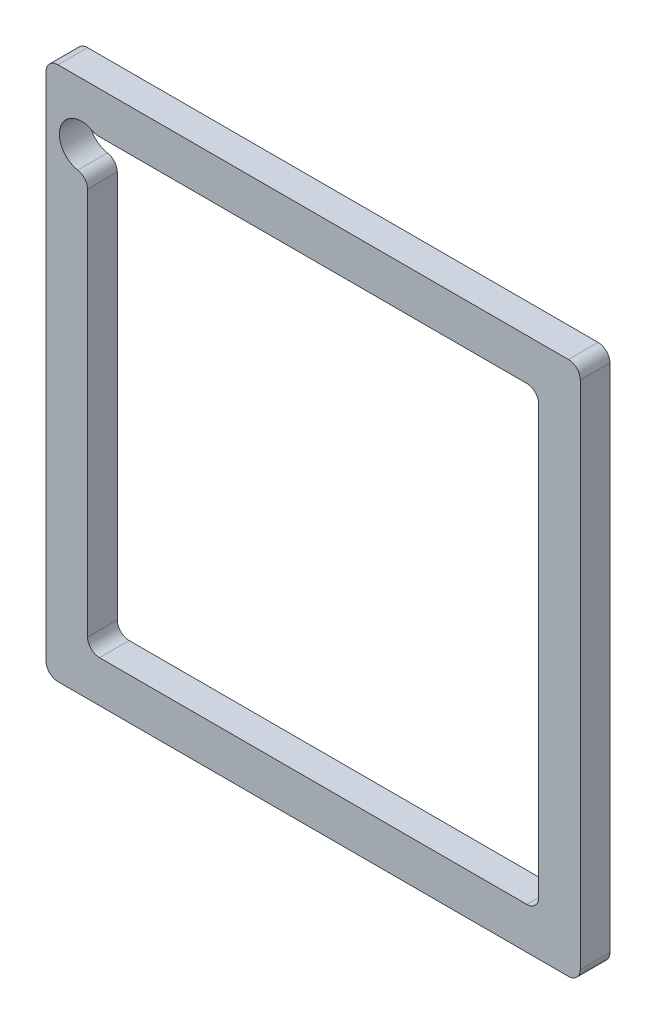
from build123d import *

# Parameters (mm, degrees)
BOSS_EXTRUDE1_DEPTH = 3.175


with BuildPart() as part:
    # Sketch1 → Boss-Extrude1 (new, symmetric)
    with BuildSketch(Plane.XY):
        with BuildLine():
            Line((-54.61, -57.15), (54.61, -57.15))
            ThreePointArc((54.61, -57.15), (56.406051224, -56.406051224), (57.15, -54.61))
            Line((57.15, -54.61), (57.15, 54.61))
            ThreePointArc((57.15, 54.61), (56.406051224, 56.406051224), (54.61, 57.15))
            Line((54.61, 57.15), (-54.61, 57.15))
            ThreePointArc((-54.61, 57.15), (-56.406051224, 56.406051224), (-57.15, 54.61))
            Line((-57.15, 54.61), (-57.15, -54.61))
            ThreePointArc((-57.15, -54.61), (-56.406051224, -56.406051224), (-54.61, -57.15))
        make_face()
        with BuildLine():
            Line((-45.72, -48.26), (11.649731947, -48.26))
            Line((11.649731947, -48.26), (45.72, -48.26))
            ThreePointArc((45.72, -48.26), (47.516051224, -47.516051224), (48.26, -45.72))
            Line((48.26, -45.72), (48.26, -17.513600374))
            Line((48.26, -17.513600374), (48.26, 45.72))
            ThreePointArc((48.26, 45.72), (47.516051224, 47.516051224), (45.72, 48.26))
            Line((45.72, 48.26), (12.317525133, 48.26))
            Line((12.317525133, 48.26), (-45.9238932, 48.26))
            ThreePointArc((-45.9238932, 48.26), (-46.572550677, 48.344222429), (-47.178191218, 48.591304348))
            ThreePointArc((-47.178191218, 48.591304348), (-54.010842502, 46.063523076), (-50.35826087, 39.760075674))
            ThreePointArc((-50.35826087, 39.760075674), (-48.854027571, 38.891201551), (-48.26, 37.2587827))
            Line((-48.26, 37.2587827), (-48.26, -0.752095073))
            Line((-48.26, -0.752095073), (-48.26, -45.72))
            ThreePointArc((-48.26, -45.72), (-47.516051224, -47.516051224), (-45.72, -48.26))
        make_face(mode=Mode.SUBTRACT)
    extrude(amount=BOSS_EXTRUDE1_DEPTH, both=True)


solid = part.part
